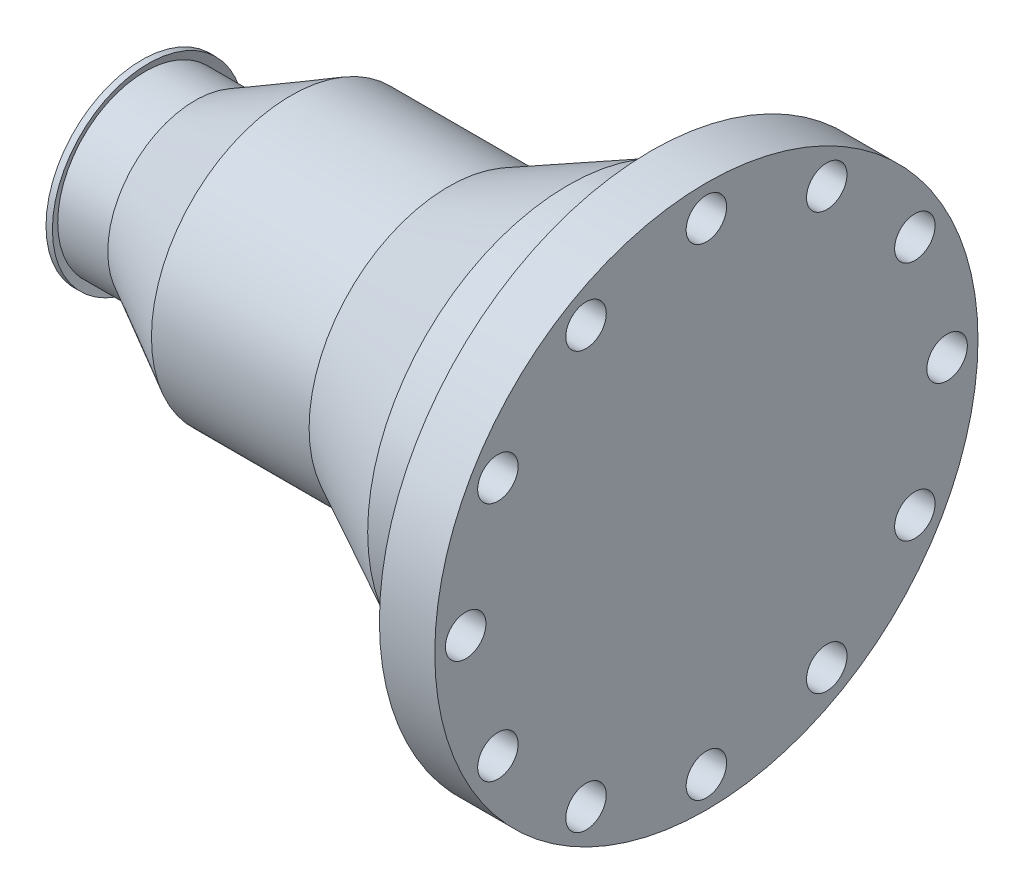
from build123d import *

# Parameters (mm, degrees)
SKETCH_3_R           = 9.5
CUT_EXTRUDE_1_DEPTH  = 321.526909947
SKETCH_4_R           = 9.5
CUT_EXTRUDE_2_DEPTH  = 321.526909947
SKETCH_5_R           = 9.5
CUT_EXTRUDE_3_DEPTH  = 321.526909947
SKETCH_6_R           = 9.5
CUT_EXTRUDE_4_DEPTH  = 321.526909947
SKETCH_7_R           = 9.5
CUT_EXTRUDE_5_DEPTH  = 321.526909947
SKETCH_8_R           = 9.5
CUT_EXTRUDE_6_DEPTH  = 321.526909947
SKETCH_9_R           = 9.5
CUT_EXTRUDE_7_DEPTH  = 321.526909947
SKETCH_10_R          = 9.5
CUT_EXTRUDE_8_DEPTH  = 321.526909947
SKETCH_11_R          = 9.5
CUT_EXTRUDE_9_DEPTH  = 321.526909947
SKETCH_12_R          = 9.5
CUT_EXTRUDE_10_DEPTH = 321.526909947
SKETCH_13_R          = 9.5
CUT_EXTRUDE_11_DEPTH = 321.526909947
SKETCH_14_R          = 9.5
CUT_EXTRUDE_12_DEPTH = 321.526909947


with BuildPart() as part:
    # Эскиз1 → Повернуть1 (revolve)
    with BuildSketch(Plane.XY, mode=Mode.PRIVATE) as revolve_1_sk:
        Polygon((0, 0), (265, 0), (265, 127.5), (239, 127.5), (239, 100), (239, 95), (220, 95), (220, 94), (200, 94), (144, 65.5), (70, 65.5), (25, 41), (1.5, 41), (3, 45), (0, 45), align=None)
    revolve(revolve_1_sk.sketch.rotate(Axis((0, 0, 0), (1, 0, 0)), 90), axis=Axis((0, 0, 0), (1, 0, 0)))

    # Эскиз3 → Вырез-Вытянуть1 (cut, through all)
    with BuildSketch(Plane(origin=(0, 0, 0), x_dir=(0, 0, -1), z_dir=(1, 0, 0))):
        with Locations((0, 113)):
            Circle(SKETCH_3_R)
    extrude(amount=CUT_EXTRUDE_1_DEPTH, mode=Mode.SUBTRACT)

    # Эскиз4 → Вырез-Вытянуть2 (cut, through all)
    with BuildSketch(Plane(origin=(0, 0, 0), x_dir=(0, 0, -1), z_dir=(1, 0, 0))):
        with Locations((-56.5, 97.860870628)):
            Circle(SKETCH_4_R)
    extrude(amount=CUT_EXTRUDE_2_DEPTH, mode=Mode.SUBTRACT)

    # Эскиз5 → Вырез-Вытянуть3 (cut, through all)
    with BuildSketch(Plane(origin=(0, 0, 0), x_dir=(0, 0, -1), z_dir=(1, 0, 0))):
        with Locations((-97.860870628, 56.5)):
            Circle(SKETCH_5_R)
    extrude(amount=CUT_EXTRUDE_3_DEPTH, mode=Mode.SUBTRACT)

    # Эскиз6 → Вырез-Вытянуть4 (cut, through all)
    with BuildSketch(Plane(origin=(0, 0, 0), x_dir=(0, 0, -1), z_dir=(1, 0, 0))):
        with Locations((-113, 0)):
            Circle(SKETCH_6_R)
    extrude(amount=CUT_EXTRUDE_4_DEPTH, mode=Mode.SUBTRACT)

    # Эскиз7 → Вырез-Вытянуть5 (cut, through all)
    with BuildSketch(Plane(origin=(0, 0, 0), x_dir=(0, 0, -1), z_dir=(1, 0, 0))):
        with Locations((-97.860870628, -56.5)):
            Circle(SKETCH_7_R)
    extrude(amount=CUT_EXTRUDE_5_DEPTH, mode=Mode.SUBTRACT)

    # Эскиз8 → Вырез-Вытянуть6 (cut, through all)
    with BuildSketch(Plane(origin=(0, 0, 0), x_dir=(0, 0, -1), z_dir=(1, 0, 0))):
        with Locations((-56.5, -97.860870628)):
            Circle(SKETCH_8_R)
    extrude(amount=CUT_EXTRUDE_6_DEPTH, mode=Mode.SUBTRACT)

    # Эскиз9 → Вырез-Вытянуть7 (cut, through all)
    with BuildSketch(Plane(origin=(0, 0, 0), x_dir=(0, 0, -1), z_dir=(1, 0, 0))):
        with Locations((0, -113)):
            Circle(SKETCH_9_R)
    extrude(amount=CUT_EXTRUDE_7_DEPTH, mode=Mode.SUBTRACT)

    # Эскиз10 → Вырез-Вытянуть8 (cut, through all)
    with BuildSketch(Plane(origin=(0, 0, 0), x_dir=(0, 0, -1), z_dir=(1, 0, 0))):
        with Locations((56.5, -97.860870628)):
            Circle(SKETCH_10_R)
    extrude(amount=CUT_EXTRUDE_8_DEPTH, mode=Mode.SUBTRACT)

    # Эскиз11 → Вырез-Вытянуть9 (cut, through all)
    with BuildSketch(Plane(origin=(0, 0, 0), x_dir=(0, 0, -1), z_dir=(1, 0, 0))):
        with Locations((97.860870628, -56.5)):
            Circle(SKETCH_11_R)
    extrude(amount=CUT_EXTRUDE_9_DEPTH, mode=Mode.SUBTRACT)

    # Эскиз12 → Вырез-Вытянуть10 (cut, through all)
    with BuildSketch(Plane(origin=(0, 0, 0), x_dir=(0, 0, -1), z_dir=(1, 0, 0))):
        with Locations((113, 0)):
            Circle(SKETCH_12_R)
    extrude(amount=CUT_EXTRUDE_10_DEPTH, mode=Mode.SUBTRACT)

    # Эскиз13 → Вырез-Вытянуть11 (cut, through all)
    with BuildSketch(Plane(origin=(0, 0, 0), x_dir=(0, 0, -1), z_dir=(1, 0, 0))):
        with Locations((97.860870628, 56.5)):
            Circle(SKETCH_13_R)
    extrude(amount=CUT_EXTRUDE_11_DEPTH, mode=Mode.SUBTRACT)

    # Эскиз14 → Вырез-Вытянуть12 (cut, through all)
    with BuildSketch(Plane(origin=(0, 0, 0), x_dir=(0, 0, -1), z_dir=(1, 0, 0))):
        with Locations((56.5, 97.860870628)):
            Circle(SKETCH_14_R)
    extrude(amount=CUT_EXTRUDE_12_DEPTH, mode=Mode.SUBTRACT)


solid = part.part
